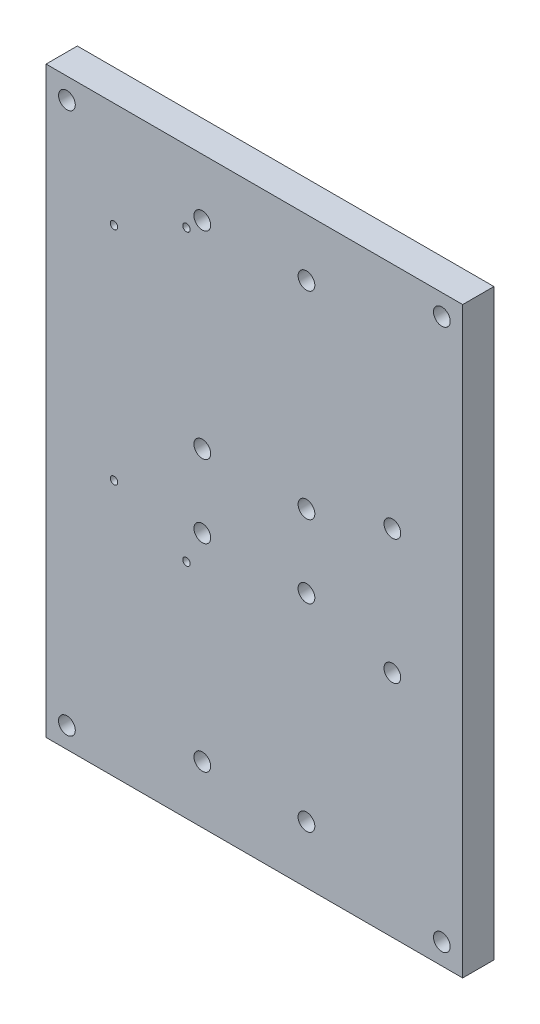
from build123d import *

# Parameters (mm, degrees)
SKETCH1_W                         = 127
SKETCH1_H                         = 177.8
BOSS_EXTRUDE1_DEPTH               = 4.7625
F_10_CLEARANCE_HOLE1_D            = 5.1054
TAPPED_HOLE_FOR_10_32_HELICOIL1_D = 5.1054
TAPPED_HOLE_FOR_10_32_HELICOIL2_D = 5.1054
F_4_40_TAPPED_HOLE1_D             = 2.2606


with BuildPart() as part:
    # Sketch1 → Boss-Extrude1 (new, symmetric)
    with BuildSketch(Plane.XY):
        Rectangle(SKETCH1_W, SKETCH1_H)
    extrude(amount=BOSS_EXTRUDE1_DEPTH, both=True)

    # #10 Clearance Hole1 (through all)
    with Locations(Plane(origin=(0, 0, -4.7625), x_dir=(-1, 0, 0), z_dir=(0, 0, -1))):
        with Locations((-57.15, 82.55), (57.15, 82.55), (57.15, -82.55), (-57.15, -82.55)):
            Hole(F_10_CLEARANCE_HOLE1_D / 2)

    # Tapped Hole for #10-32 Helicoil1 (through all)
    with Locations(Plane(origin=(0, 0, -4.7625), x_dir=(-1, 0, 0), z_dir=(0, 0, -1))):
        with Locations((-15.875, 71.4375), (15.875, 11.1125), (-15.875, 11.1125), (15.875, 71.4375), (-15.875, -11.1125), (15.875, -71.4375), (-15.875, -71.4375), (15.875, -11.1125)):
            Hole(TAPPED_HOLE_FOR_10_32_HELICOIL1_D / 2)

    # Tapped Hole for #10-32 Helicoil2 (through all)
    with Locations(Plane(origin=(0, 0, -4.7625), x_dir=(-1, 0, 0), z_dir=(0, 0, -1))):
        with Locations((-42.06875, 19.05), (-42.06875, -19.05)):
            Hole(TAPPED_HOLE_FOR_10_32_HELICOIL2_D / 2)

    # #4-40 Tapped Hole1 (through all)
    with Locations(Plane.XY.offset(4.7625)):
        with Locations((-20.701, 67.1195), (-42.799, 56.7055), (-20.701, -21.082), (-42.799, -10.668)):
            Hole(F_4_40_TAPPED_HOLE1_D / 2)


solid = part.part
